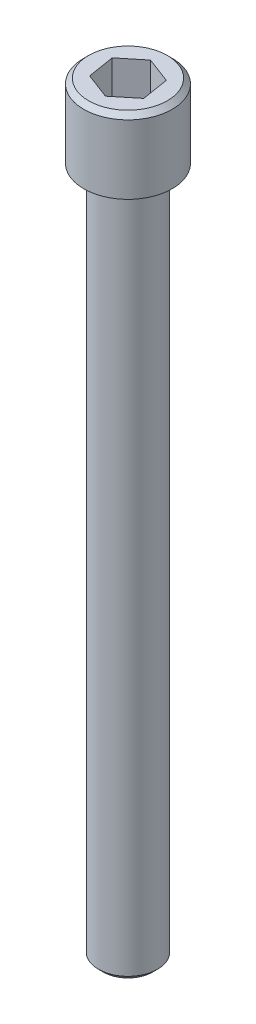
from build123d import *

# Parameters (mm, degrees)
SKICA1_R                 = 1.5
P_IDAT_VYSUNUT_M1_DEPTH  = 35
SKICA2_R                 = 2.25
P_IDAT_VYSUNUT_M2_DEPTH  = 3.75
ODEBRAT_VYSUNUT_M1_DEPTH = 2.25
ZKOSEN_1_SIZE            = 0.25
ZKOSEN_2_SIZE            = 0.25


with BuildPart() as part:
    # Skica1 → Přidat vysunutím1 (new body)
    with BuildSketch(Plane(origin=(0, 0, 0), x_dir=(1, 0, 0), z_dir=(0, 1, 0))):
        with Locations(Location((0, 0, 0), (0, 0, 270))):
            Circle(SKICA1_R)
    extrude(amount=P_IDAT_VYSUNUT_M1_DEPTH)

    # Skica2 → Přidat vysunutím2 (add)
    with BuildSketch(Plane(origin=(0, 35, 0), x_dir=(1, 0, 0), z_dir=(0, 1, 0))):
        with Locations(Location((0, 0, 0), (0, 0, 270))):
            Circle(SKICA2_R)
    extrude(amount=P_IDAT_VYSUNUT_M2_DEPTH)

    # Skica3 → Odebrat vysunutím1 (cut)
    with BuildSketch(Plane(origin=(0, 38.75, 0), x_dir=(1, 0, 0), z_dir=(0, 1, 0))):
        Polygon((-1.074402598, -0.875019461), (0.220587783, -1.367969674), (1.294990381, -0.492950213), (1.074402598, 0.875019461), (-0.220587783, 1.367969674), (-1.294990381, 0.492950213), align=None)
    extrude(amount=-ODEBRAT_VYSUNUT_M1_DEPTH, mode=Mode.SUBTRACT)

    # Zkosení1
    zkosen_1_edges = [part.edges().sort_by_distance(p)[0] for p in [
        (0, 38.75, -2.25),
    ]]
    chamfer(zkosen_1_edges, length=ZKOSEN_1_SIZE)

    # Zkosení2
    zkosen_2_edges = [part.edges().sort_by_distance(p)[0] for p in [
        (0, 0, -1.5),
    ]]
    chamfer(zkosen_2_edges, length=ZKOSEN_2_SIZE)


solid = part.part
